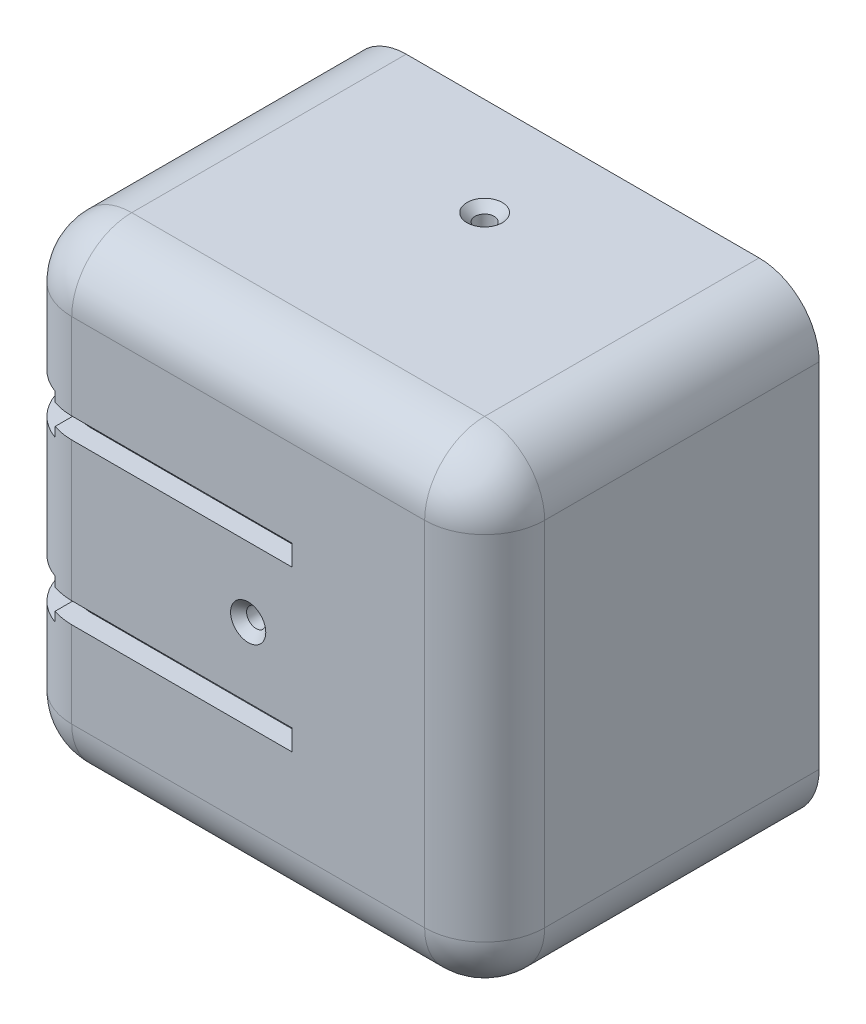
from build123d import *

# Parameters (mm, degrees)
SKETCH1_W                                            = 59.1
SKETCH1_H                                            = 59.1
BOSS_EXTRUDE1_DEPTH                                  = 59.1
CUT_EXTRUDE1_START                                   = -2.25
SKETCH2_W                                            = 116.357411776
SKETCH2_H                                            = 94.431830133
CUT_EXTRUDE1_DEPTH                                   = 71.232302632
FILLET1_R                                            = 7.5
SHELL1_T                                             = -2.5
CUT_EXTRUDE7_DEPTH                                   = 35
CUT_EXTRUDE8_DEPTH                                   = 35
SKETCH16_W                                           = 0.690169944
SKETCH16_H                                           = 5
CUT_EXTRUDE9_DEPTH                                   = 88.003290168
BOSS_EXTRUDE2_START                                  = 3
SKETCH18_R                                           = 5
BOSS_EXTRUDE2_DEPTH                                  = 3
SKETCH17_R                                           = 1.5
CUT_EXTRUDE10_DEPTH                                  = 10
CUT_EXTRUDE11_REACH                                  = 90.65
CSK_SLOT_FOR_M2_COUNTERSUNK_FLAT_HEAD_SC_D           = 2.4
CSK_SLOT_FOR_M2_COUNTERSUNK_FLAT_HEAD_SC_CSINK_D     = 4.4
CSK_SLOT_FOR_M2_COUNTERSUNK_FLAT_HEAD_SC_CSINK_ANGLE = 90
CSK_SLOT_FOR_M2_COUNTERSUNK_FLAT_HEA_2_D             = 2.4
CSK_SLOT_FOR_M2_COUNTERSUNK_FLAT_HEA_2_CSINK_D       = 4.4
CSK_SLOT_FOR_M2_COUNTERSUNK_FLAT_HEA_2_CSINK_ANGLE   = 90
CSK_SLOT_FOR_M2_COUNTERSUNK_FLAT_HEA_3_D             = 2.4
CSK_SLOT_FOR_M2_COUNTERSUNK_FLAT_HEA_3_CSINK_D       = 4.4
CSK_SLOT_FOR_M2_COUNTERSUNK_FLAT_HEA_3_CSINK_ANGLE   = 90
BOSS_EXTRUDE3_DEPTH                                  = 35
SKETCH28_W                                           = 7.5
SKETCH28_H                                           = 5.1
CUT_EXTRUDE12_DEPTH                                  = 62.984090748


with BuildPart() as part:
    # Sketch1 → Boss-Extrude1 (new body)
    with BuildSketch(Plane.XY):
        Rectangle(SKETCH1_W, SKETCH1_H)
    extrude(amount=BOSS_EXTRUDE1_DEPTH)

    # Sketch2 → Cut-Extrude1 (cut, through all)
    with BuildSketch(Plane(origin=(-13.400446417, -13.400446417, 19.55), x_dir=(0.9659258262890684, -0.2588190451025203, 0), z_dir=(0, 0, 1)).offset(CUT_EXTRUDE1_START)):
        with Locations((15.241895832, 15.980077556)):
            Rectangle(SKETCH2_W, SKETCH2_H)
    extrude(amount=-CUT_EXTRUDE1_DEPTH, mode=Mode.SUBTRACT)

    # Fillet1
    fillet1_edges = [part.edges().sort_by_distance(p)[0] for p in [
        (29.55, 0, 59.1),
        (0, 29.55, 59.1),
        (-29.55, 0, 59.1),
        (0, -29.55, 59.1),
        (-29.55, 29.55, 38.2),
        (29.55, 29.55, 38.2),
        (29.55, -29.55, 38.2),
        (-29.55, -29.55, 38.2),
    ]]
    fillet(fillet1_edges, radius=FILLET1_R)

    # Shell1
    shell1_openings = [part.faces().sort_by_distance(p)[0] for p in [
        (0, 0, 17.3),
    ]]
    offset(amount=SHELL1_T, openings=shell1_openings, kind=Kind.INTERSECTION)

    # Sketch14 → Cut-Extrude7 (cut)
    with BuildSketch(Plane.XY.offset(59.1)):
        Polygon((-29.55, -8.7), (-27.05, -8.7), (-27.05, -7.5), (-24.55, -7.5), (-24.55, -12.5), (-27.05, -12.5), (-27.05, -11.3), (-29.55, -11.3), align=None)
        Polygon((-29.55, 11.3), (-29.55, 8.7), (-27.05, 8.7), (-27.05, 7.5), (-24.55, 7.5), (-24.55, 12.5), (-27.05, 12.5), (-27.05, 11.3), align=None)
    extrude(amount=-CUT_EXTRUDE7_DEPTH, mode=Mode.SUBTRACT)

    # Sketch15 → Cut-Extrude8 (cut)
    with BuildSketch(Plane(origin=(-29.55, 0, -29.55), x_dir=(0, 0, -1), z_dir=(1, 0, 0))):
        Polygon((-88.65, -8.7), (-86.05, -8.7), (-86.05, -7.5), (-83.45, -7.5), (-83.45, -12.5), (-86.05, -12.5), (-86.05, -11.3), (-88.65, -11.3), align=None)
        Polygon((-88.65, 11.3), (-88.65, 8.7), (-86.05, 8.7), (-86.05, 7.5), (-83.45, 7.5), (-83.45, 12.5), (-86.05, 12.5), (-86.05, 11.3), align=None)
    extrude(amount=CUT_EXTRUDE8_DEPTH, mode=Mode.SUBTRACT)

    # Sketch16 → Cut-Extrude9 (cut, through all)
    with BuildSketch(Plane(origin=(-27.05, 0, 0), x_dir=(0, 0, -1), z_dir=(1, 0, 0))):
        with Locations((-56.845084972, -10)):
            Rectangle(SKETCH16_W, SKETCH16_H)
        with Locations((-56.845084972, 10)):
            Rectangle(SKETCH16_W, SKETCH16_H)
    extrude(amount=-CUT_EXTRUDE9_DEPTH, mode=Mode.SUBTRACT)

    # Sketch18 → Boss-Extrude2 (add)
    with BuildSketch(Plane(origin=(0, -27.05, 0), x_dir=(1, 0, 0), z_dir=(0, 1, 0)).offset(BOSS_EXTRUDE2_START)):
        with Locations((-22.05, -51.6)):
            Circle(SKETCH18_R)
    extrude(amount=-BOSS_EXTRUDE2_DEPTH)

    # Sketch17 → Cut-Extrude10 (cut)
    with BuildSketch(Plane.XZ.offset(29.55)):
        with Locations(Location((-22.05, 51.6, 0), (0, 0, 90))):
            Circle(SKETCH17_R)
    extrude(amount=-CUT_EXTRUDE10_DEPTH, mode=Mode.SUBTRACT)

    # Sketch20 → Cut-Extrude11 (cut, up to next)
    with BuildSketch(Plane.XZ.offset(29.55), mode=Mode.PRIVATE) as cut_extrude11_sk1:
        with BuildLine():
            Line((-22.647878988, 52.975696447), (-23.072143057, 53.399960516))
            Line((-23.072143057, 53.399960516), (-23.849960516, 52.622143057))
            Line((-23.849960516, 52.622143057), (-23.425696447, 52.197878988))
            ThreePointArc((-23.425696447, 52.197878988), (-23.110660172, 52.660660172), (-22.647878988, 52.975696447))
        make_face()
    cut_extrude11_tool1 = extrude(cut_extrude11_sk1.sketch, amount=-CUT_EXTRUDE11_REACH, mode=Mode.PRIVATE) & part.part
    # Sketch20 → Cut-Extrude11 (cut, up to next)
    with BuildSketch(Plane.XZ.offset(29.55), mode=Mode.PRIVATE) as cut_extrude11_sk2:
        with BuildLine():
            Line((-21.027856943, 49.800039484), (-21.452121012, 50.224303553))
            ThreePointArc((-21.452121012, 50.224303553), (-20.989339828, 50.539339828), (-20.674303553, 51.002121012))
            Line((-20.674303553, 51.002121012), (-20.250039484, 50.577856943))
            Line((-20.250039484, 50.577856943), (-21.027856943, 49.800039484))
        make_face()
    cut_extrude11_tool2 = extrude(cut_extrude11_sk2.sketch, amount=-CUT_EXTRUDE11_REACH, mode=Mode.PRIVATE) & part.part
    add(cut_extrude11_tool1.solids().sort_by_distance((-23.27308, -29.55, 52.82308))[0], mode=Mode.SUBTRACT)
    add(cut_extrude11_tool2.solids().sort_by_distance((-20.82692, -29.55, 50.37692))[0], mode=Mode.SUBTRACT)

    # CSK SLOT for M2 Countersunk Flat Head Sc (through all)
    with Locations(Plane.ZX.offset(29.55)):
        with Locations((29.55, 0)):
            CounterSinkHole(CSK_SLOT_FOR_M2_COUNTERSUNK_FLAT_HEAD_SC_D / 2, CSK_SLOT_FOR_M2_COUNTERSUNK_FLAT_HEAD_SC_CSINK_D / 2, counter_sink_angle=CSK_SLOT_FOR_M2_COUNTERSUNK_FLAT_HEAD_SC_CSINK_ANGLE)

    # CSK SLOT for M2 Countersunk Flat Hea 2 (through all)
    with Locations(Plane.XY.offset(59.1)):
        with Locations((0, 0)):
            CounterSinkHole(CSK_SLOT_FOR_M2_COUNTERSUNK_FLAT_HEA_2_D / 2, CSK_SLOT_FOR_M2_COUNTERSUNK_FLAT_HEA_2_CSINK_D / 2, counter_sink_angle=CSK_SLOT_FOR_M2_COUNTERSUNK_FLAT_HEA_2_CSINK_ANGLE)

    # CSK SLOT for M2 Countersunk Flat Hea 3 (through all)
    with Locations(Plane(origin=(0, -29.55, 0), x_dir=(-1, 0, 0), z_dir=(0, -1, 0))):
        with Locations((0, -29.55)):
            CounterSinkHole(CSK_SLOT_FOR_M2_COUNTERSUNK_FLAT_HEA_3_D / 2, CSK_SLOT_FOR_M2_COUNTERSUNK_FLAT_HEA_3_CSINK_D / 2, counter_sink_angle=CSK_SLOT_FOR_M2_COUNTERSUNK_FLAT_HEA_3_CSINK_ANGLE)

    # Sketch27 → Boss-Extrude3 (add)
    with BuildSketch(Plane(origin=(-29.55, 29.55, 0), x_dir=(0, 0, -1), z_dir=(1, 0, 0))):
        Polygon((-18.3, -59.1), (-18.3, -61.7), (-17.05, -61.7), (-17.05, -64.2), (-22.05, -64.2), (-22.05, -61.7), (-20.8, -61.7), (-20.8, -59.1), align=None)
        Polygon((-38.3, -59.1), (-40.8, -59.1), (-40.8, -61.7), (-42.05, -61.7), (-42.05, -64.2), (-37.05, -64.2), (-37.05, -61.7), (-38.3, -61.7), align=None)
    extrude(amount=BOSS_EXTRUDE3_DEPTH)

    # Sketch28 → Cut-Extrude12 (cut, through all)
    with BuildSketch(Plane.XY.offset(59.1)):
        with Locations((-25.8, -32.1)):
            Rectangle(SKETCH28_W, SKETCH28_H)
    extrude(amount=-CUT_EXTRUDE12_DEPTH, mode=Mode.SUBTRACT)


solid = part.part
